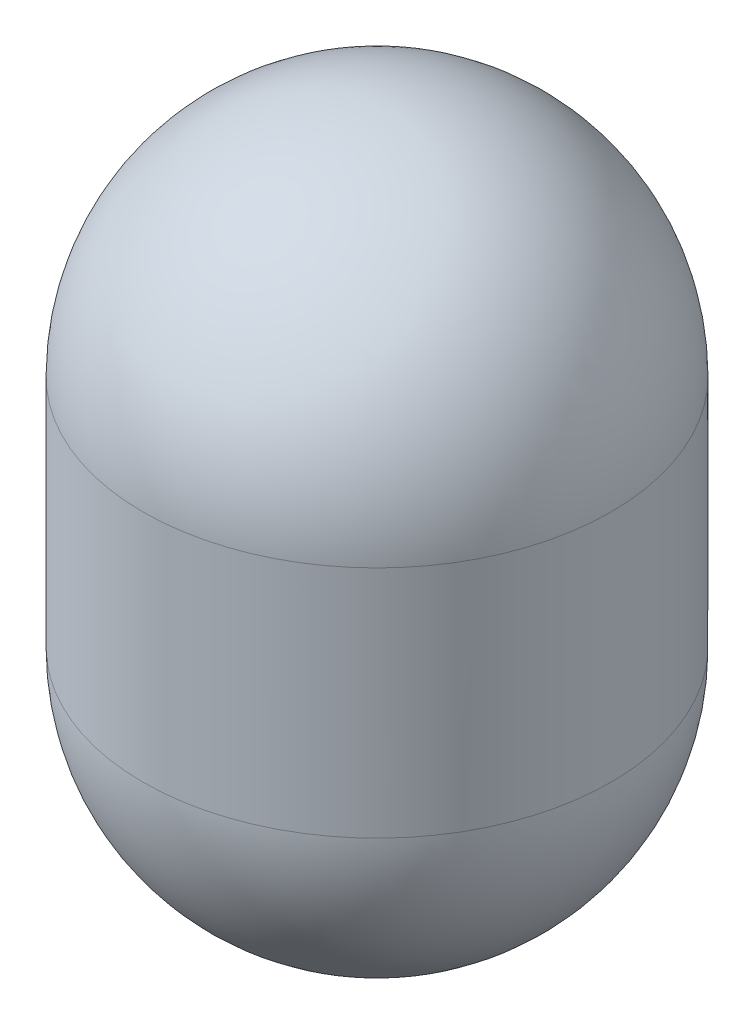
from build123d import *


with BuildPart() as part:
    # Sketch1 → Revolve1 (revolve)
    with BuildSketch(Plane.XY, mode=Mode.PRIVATE) as revolve1_sk:
        with BuildLine():
            Line((-303, 0), (-303, -303))
            ThreePointArc((-303, -303), (-214.2533547, -517.2533547), (0, -606))
            Line((0, -606), (0, -602))
            ThreePointArc((0, -602), (-211.424927575, -514.424927575), (-299, -303))
            Line((-299, -303), (-299, 0))
            ThreePointArc((-299, 0), (-211.424927575, 211.424927575), (0, 299))
            Line((0, 299), (0, 303))
            ThreePointArc((0, 303), (-214.2533547, 214.2533547), (-303, 0))
        make_face()
    revolve(revolve1_sk.sketch.rotate(Axis((0, 0, 0), (0, -1, 0)), 270), axis=Axis((0, 0, 0), (0, -1, 0)))


solid = part.part
